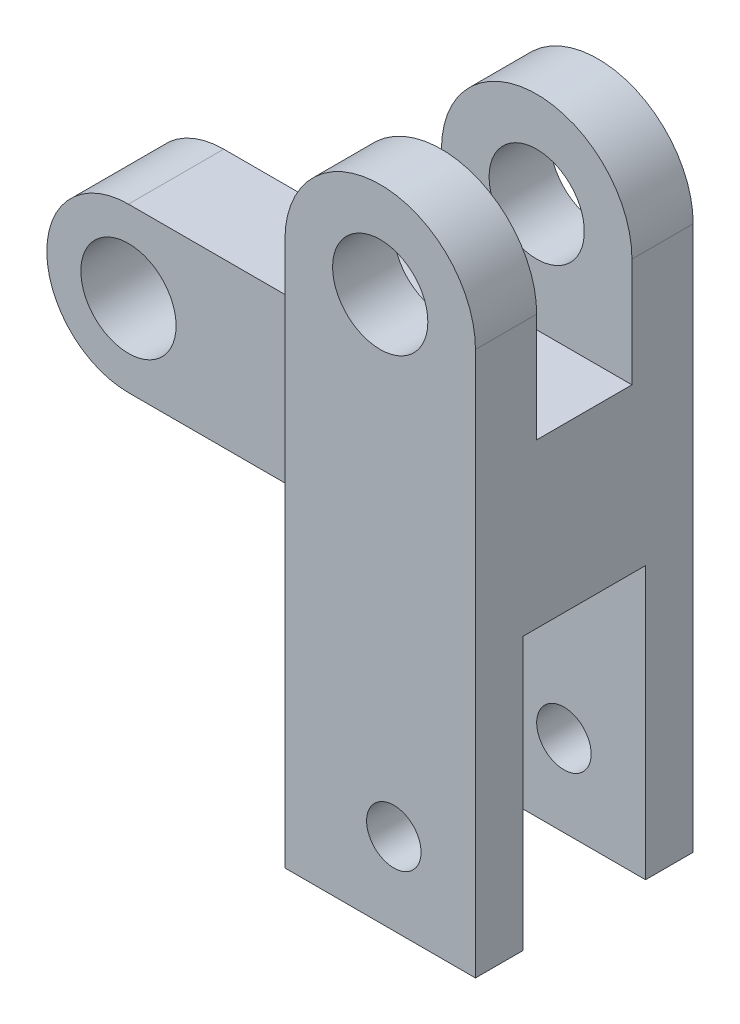
from build123d import *
from build123d.topology import SkipClean

# Parameters (mm, degrees)
SKETCH_1_W          = 7
SKETCH_1_H          = 7
EXTRUDE_1_DEPTH     = 2.4
EXTRUDE_6_DEPTH     = 1.75
EXTRUDE_START       = -5.25
EXTRUDE_8_DEPTH     = 1.75
SKETCH_11_R         = 1.75
CUT_EXTRUDE_1_DEPTH = 20.241881405
SKETCH_17_W         = 7
SKETCH_17_H         = 7
EXTRUDE_10_DEPTH    = 7
SKETCH_15_R         = 1.75
EXTRUDE_9_DEPTH     = 1.75
SKETCH_12_R         = 1
CUT_EXTRUDE_2_DEPTH = 19.062391868
SKETCH_18_W         = 7
SKETCH_18_H         = 4.5
CUT_EXTRUDE_4_DEPTH = 10
SKETCH_19_R         = 1
SKETCH_19_R_2       = 1.75
EXTRUDE_11_DEPTH    = 0.5
EXTRUDE_START_2     = 0.5
SKETCH_20_R         = 1
SKETCH_20_R_2       = 1.75
EXTRUDE_12_DEPTH    = 0.5


with BuildPart() as part:
    # 草图1 → 凸台-拉伸1 (new body)
    with BuildSketch(Plane(origin=(0, 0, 0), x_dir=(1, 0, 0), z_dir=(0, 1, 0))):
        with Locations((3.5, 0)):
            Rectangle(SKETCH_1_W, SKETCH_1_H)
    extrude(amount=EXTRUDE_1_DEPTH)

    # 草图10 → 凸台-拉伸6 (add)
    with BuildSketch(Plane(origin=(0, 0, -3.5), x_dir=(-1, 0, 0), z_dir=(0, 0, -1))):
        with BuildLine():
            Line((-7, 13), (-7, 2.4))
            Line((-7, 2.4), (0, 2.4))
            Line((0, 2.4), (0, 13))
            ThreePointArc((0, 13), (-3.5, 16.5), (-7, 13))
        make_face()
    extrude(amount=-EXTRUDE_6_DEPTH)

    # 草图10<2> → 凸台-拉伸8 (add)
    with BuildSketch(Plane(origin=(0, 0, -3.5), x_dir=(-1, 0, 0), z_dir=(0, 0, -1)).offset(EXTRUDE_START)):
        with BuildLine():
            Line((-7, 13), (-7, 2.4))
            Line((-7, 2.4), (0, 2.4))
            Line((0, 2.4), (0, 13))
            ThreePointArc((0, 13), (-3.5, 16.5), (-7, 13))
        make_face()
    extrude(amount=-EXTRUDE_8_DEPTH)

    # 草图11 → 切除-拉伸1 (cut, through all)
    with BuildSketch(Plane(origin=(0, 0, -3.5), x_dir=(-1, 0, 0), z_dir=(0, 0, -1))):
        with Locations((-3.5, 13)):
            Circle(SKETCH_11_R)
    extrude(amount=-CUT_EXTRUDE_1_DEPTH, mode=Mode.SUBTRACT)

    # 草图17 → 凸台-拉伸10 (add)
    with BuildSketch(Plane.XZ):
        with Locations((3.5, 0)):
            Rectangle(SKETCH_17_W, SKETCH_17_H)
    extrude(amount=EXTRUDE_10_DEPTH)

    # 草图15 → 凸台-拉伸9 (add, symmetric)
    with BuildSketch(Plane.XY):
        with BuildLine():
            Line((7, 3), (7, 9))
            Line((7, 9), (-8, 9))
            ThreePointArc((-8, 9), (-11, 6), (-8, 3))
            Line((-8, 3), (7, 3))
        make_face()
        with Locations((-8, 6)):
            Circle(SKETCH_15_R, mode=Mode.SUBTRACT)
    extrude(amount=EXTRUDE_9_DEPTH, both=True)

    # 草图12 → 切除-拉伸2 (cut, through all)
    with BuildSketch(Plane(origin=(0, 4, 3.5), x_dir=(1, 0, 0), z_dir=(0, 0, -1))):
        with Locations((4, 8)):
            Circle(SKETCH_12_R)
    extrude(amount=CUT_EXTRUDE_2_DEPTH, mode=Mode.SUBTRACT)

    # 草图18 → 切除-拉伸4 (cut)
    with BuildSketch(Plane(origin=(7.4, -7, 0), x_dir=(1, 0, 0), z_dir=(0, 1, 0))):
        with Locations((-3.9, 0)):
            Rectangle(SKETCH_18_W, SKETCH_18_H)
    extrude(amount=CUT_EXTRUDE_4_DEPTH, mode=Mode.SUBTRACT)

    # 草图19 → 凸台-拉伸11 (add)
    with SkipClean():  # the faces are left unmerged after this step: merging them gives an invalid solid
        with BuildSketch(Plane.XY.offset(3.5)):
            with BuildLine():
                Line((0, 13), (0, -7))
                Line((0, -7), (7, -7))
                Line((7, -7), (7, 13))
                ThreePointArc((7, 13), (3.5, 16.5), (0, 13))
            make_face()
            with Locations((4, -4)):
                Circle(SKETCH_19_R, mode=Mode.SUBTRACT)
            with Locations((3.5, 13)):
                Circle(SKETCH_19_R_2, mode=Mode.SUBTRACT)
        extrude(amount=EXTRUDE_11_DEPTH)

    # 草图20 → 凸台-拉伸12 (add)
    with SkipClean():  # the faces are left unmerged after this step: merging them gives an invalid solid
        with BuildSketch(Plane(origin=(0, 0, -3.5), x_dir=(-1, 0, 0), z_dir=(0, 0, -1)).offset(EXTRUDE_START_2)):
            with BuildLine():
                Line((-7, 13), (-7, -7))
                Line((-7, -7), (0, -7))
                Line((0, -7), (0, 13))
                ThreePointArc((0, 13), (-3.5, 16.5), (-7, 13))
            make_face()
            with Locations((-4, -4)):
                Circle(SKETCH_20_R, mode=Mode.SUBTRACT)
            with Locations((-3.5, 13)):
                Circle(SKETCH_20_R_2, mode=Mode.SUBTRACT)
        extrude(amount=-EXTRUDE_12_DEPTH)


solid = part.part
